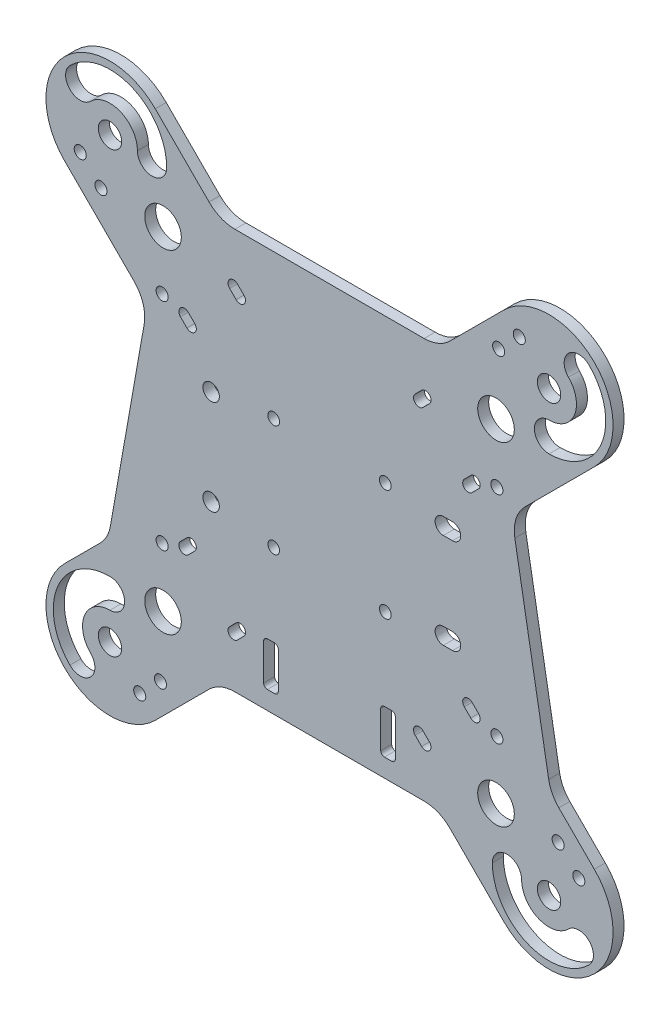
from build123d import *

# Parameters (mm, degrees)
AUFSATZ_LINEAR_AUSTRAGEN1_DEPTH = 3
SKIZZE2_R                       = 5
SKIZZE2_R_2                     = 3.2
SCHNITT_LINEAR_AUSTRAGEN1_DEPTH = 3
SKIZZE3_R                       = 3.2
SCHNITT_LINEAR_AUSTRAGEN2_DEPTH = 3
SKIZZE5_R                       = 1.6
SKIZZE5_R_2                     = 2.25
SCHNITT_LINEAR_AUSTRAGEN3_DEPTH = 3
SKIZZE7_R                       = 0.5
SCHNITT_LINEAR_AUSTRAGEN4_DEPTH = 110.64260121
VERRUNDUNG1_R                   = 10
ECSS_BEFESTIGUNG_DEPTH          = 110.64260121
SKIZZE9_R                       = 0.5
SCHNITT_LINEAR_AUSTRAGEN6_DEPTH = 110.64260121
KREISMUSTER1_COUNT              = 4
SKIZZE10_W                      = 4
SKIZZE10_H                      = 12
BEFESTIGUNG_SPANNTESTER_DEPTH   = 110.64260121
VERRUNDUNG2_R                   = 1
M4_GEWINDEBOHRUNG1_D            = 3.3
SKIZZE16_R                      = 0.5
SCHNITT_LINEAR_AUSTRAGEN8_DEPTH = 110.64260121
M4_GEWINDEBOHRUNG2_D            = 3.3


with BuildPart() as part:
    # Skizze1 → Aufsatz-Linear austragen1 (new body)
    with BuildSketch(Plane.XY):
        with BuildLine():
            Line((30, 54.748737342), (-30, 54.748737342))
            Line((-30, 54.748737342), (-47.625631329, 72.374368671))
            ThreePointArc((-47.625631329, 72.374368671), (-72.374368671, 72.374368671), (-72.374368671, 47.625631329))
            Line((-72.374368671, 47.625631329), (-49.748737342, 25))
            Line((-49.748737342, 25), (-60.45243751, -35.703700169))
            Line((-60.45243751, -35.703700169), (-72.374368671, -47.625631329))
            ThreePointArc((-72.374368671, -47.625631329), (-72.374368671, -72.374368671), (-47.625631329, -72.374368671))
            Line((-47.625631329, -72.374368671), (-30, -54.748737342))
            Line((-30, -54.748737342), (30, -54.748737342))
            Line((30, -54.748737342), (47.625631329, -72.374368671))
            ThreePointArc((47.625631329, -72.374368671), (72.374368671, -72.374368671), (72.374368671, -47.625631329))
            Line((72.374368671, -47.625631329), (60.45243751, -35.703700169))
            Line((60.45243751, -35.703700169), (49.748737342, 25))
            Line((49.748737342, 25), (72.374368671, 47.625631329))
            ThreePointArc((72.374368671, 47.625631329), (72.374368671, 72.374368671), (47.625631329, 72.374368671))
            Line((47.625631329, 72.374368671), (30, 54.748737342))
        make_face()
    extrude(amount=AUFSATZ_LINEAR_AUSTRAGEN1_DEPTH)

    # Skizze2 → Schnitt-Linear austragen1 (cut)
    with BuildSketch(Plane.XY.offset(3)):
        with Locations((-45.504310986, 45.504310986)):
            Circle(SKIZZE2_R)
        with Locations((-60, 60)):
            Circle(SKIZZE2_R_2)
        with Locations((45.504310986, 45.504310986)):
            Circle(SKIZZE2_R)
        with Locations((45.504310986, -45.504310986)):
            Circle(SKIZZE2_R)
        with Locations((-45.504310986, -45.504310986)):
            Circle(SKIZZE2_R)
        with Locations((-60, -60)):
            Circle(SKIZZE2_R_2)
        with Locations((60, 60)):
            Circle(SKIZZE2_R_2)
        with Locations((60, -60)):
            Circle(SKIZZE2_R_2)
    extrude(amount=-SCHNITT_LINEAR_AUSTRAGEN1_DEPTH, mode=Mode.SUBTRACT)

    # Skizze3 → Schnitt-Linear austragen2 (cut)
    with BuildSketch(Plane.XY.offset(3)):
        with Locations((-60, 60)):
            Circle(SKIZZE3_R)
        with BuildLine():
            ThreePointArc((65.303300859, 65.303300859), (65.303300859, 70.960155108), (70.960155108, 70.960155108))
            ThreePointArc((70.960155108, 70.960155108), (74.320132754, 54.068406798), (60, 44.5))
            ThreePointArc((60, 44.5), (56, 48.5), (60, 52.5))
            ThreePointArc((60, 52.5), (66.929096494, 57.129874257), (65.303300859, 65.303300859))
        make_face()
        with BuildLine():
            ThreePointArc((-70.960155108, 70.960155108), (-54.068406798, 74.320132754), (-44.5, 60))
            ThreePointArc((-44.5, 60), (-48.5, 56), (-52.5, 60))
            ThreePointArc((-52.5, 60), (-57.129874257, 66.929096494), (-65.303300859, 65.303300859))
            ThreePointArc((-65.303300859, 65.303300859), (-70.960155108, 65.303300859), (-70.960155108, 70.960155108))
        make_face()
        with BuildLine():
            ThreePointArc((65.303300859, -65.303300859), (57.129874257, -66.929096494), (52.5, -60))
            ThreePointArc((52.5, -60), (48.5, -56), (44.5, -60))
            ThreePointArc((44.5, -60), (54.068406798, -74.320132754), (70.960155108, -70.960155108))
            ThreePointArc((70.960155108, -70.960155108), (70.960155108, -65.303300859), (65.303300859, -65.303300859))
        make_face()
        with BuildLine():
            ThreePointArc((-70.960155108, -70.960155108), (-74.320132754, -54.068406798), (-60, -44.5))
            ThreePointArc((-60, -44.5), (-56, -48.5), (-60, -52.5))
            ThreePointArc((-60, -52.5), (-66.929096494, -57.129874257), (-65.303300859, -65.303300859))
            ThreePointArc((-65.303300859, -65.303300859), (-65.303300859, -70.960155108), (-70.960155108, -70.960155108))
        make_face()
    extrude(amount=-SCHNITT_LINEAR_AUSTRAGEN2_DEPTH, mode=Mode.SUBTRACT)

    # Skizze5 → Schnitt-Linear austragen3 (cut)
    with BuildSketch(Plane.XY.offset(3)):
        with Locations((-15.25, 15.25)):
            Circle(SKIZZE5_R)
        with Locations((15.25, 15.25)):
            Circle(SKIZZE5_R)
        with Locations((15.25, -15.25)):
            Circle(SKIZZE5_R)
        with Locations((-15.25, -15.25)):
            Circle(SKIZZE5_R)
        with Locations((-32.36, 13)):
            Circle(SKIZZE5_R_2)
        with Locations((-32.36, -13)):
            Circle(SKIZZE5_R_2)
        with BuildLine():
            Line((31.11, 15.25), (33.61, 15.25))
            ThreePointArc((33.61, 15.25), (35.86, 13), (33.61, 10.75))
            Line((33.61, 10.75), (31.11, 10.75))
            ThreePointArc((31.11, 10.75), (28.86, 13), (31.11, 15.25))
        make_face()
        with BuildLine():
            Line((31.11, -10.75), (33.61, -10.75))
            ThreePointArc((33.61, -10.75), (35.86, -13), (33.61, -15.25))
            Line((33.61, -15.25), (31.11, -15.25))
            ThreePointArc((31.11, -15.25), (28.86, -13), (31.11, -10.75))
        make_face()
    extrude(amount=-SCHNITT_LINEAR_AUSTRAGEN3_DEPTH, mode=Mode.SUBTRACT)

    # Skizze7 → Schnitt-Linear austragen4 (cut, through all)
    with BuildSketch(Plane.XY.offset(3)):
        with Locations((-45.748737342, 29.5)):
            Circle(SKIZZE7_R)
        with Locations((-45.748737342, -29.5)):
            Circle(SKIZZE7_R)
        with Locations((45.748737342, -29.5)):
            Circle(SKIZZE7_R)
        with Locations((45.748737342, 29.5)):
            Circle(SKIZZE7_R)
    extrude(amount=-SCHNITT_LINEAR_AUSTRAGEN4_DEPTH, mode=Mode.SUBTRACT)

    # Verrundung1
    verrundung1_edges = [part.edges().sort_by_distance(p)[0] for p in [
        (-30, 54.748737342, 1.5),
        (30, 54.748737342, 1.5),
        (49.748737342, 25, 1.5),
        (60.45243751, -35.703700169, 1.5),
        (30, -54.748737342, 1.5),
        (-30, -54.748737342, 1.5),
        (-60.45243751, -35.703700169, 1.5),
        (-49.748737342, 25, 1.5),
    ]]
    fillet(verrundung1_edges, radius=VERRUNDUNG1_R)

    # Skizze8 → ECSs Befestigung (cut, through all)
    with BuildSketch(Plane.XY.offset(3)):
        with BuildLine():
            Line((25.528544417, -38.256466479), (27.29631137, -40.024233431))
            ThreePointArc((27.29631137, -40.024233431), (27.29631137, -42.145553775), (25.174991027, -42.145553775))
            Line((25.174991027, -42.145553775), (23.407224074, -40.377786822))
            ThreePointArc((23.407224074, -40.377786822), (23.407224074, -38.256466479), (25.528544417, -38.256466479))
        make_face()
        with BuildLine():
            Line((38.610019869, -28.710524932), (36.842252916, -26.94275798))
            ThreePointArc((36.842252916, -26.94275798), (36.842252916, -24.821437636), (38.96357326, -24.821437636))
            Line((38.96357326, -24.821437636), (40.731340213, -26.589204589))
            ThreePointArc((40.731340213, -26.589204589), (40.731340213, -28.710524932), (38.610019869, -28.710524932))
        make_face()
        with BuildLine():
            Line((-38.610019869, -28.710524932), (-36.842252916, -26.94275798))
            ThreePointArc((-36.842252916, -26.94275798), (-36.842252916, -24.821437636), (-38.96357326, -24.821437636))
            Line((-38.96357326, -24.821437636), (-40.731340213, -26.589204589))
            ThreePointArc((-40.731340213, -26.589204589), (-40.731340213, -28.710524932), (-38.610019869, -28.710524932))
        make_face()
        with BuildLine():
            Line((-25.528544417, -38.256466479), (-27.29631137, -40.024233431))
            ThreePointArc((-27.29631137, -40.024233431), (-27.29631137, -42.145553775), (-25.174991027, -42.145553775))
            Line((-25.174991027, -42.145553775), (-23.407224074, -40.377786822))
            ThreePointArc((-23.407224074, -40.377786822), (-23.407224074, -38.256466479), (-25.528544417, -38.256466479))
        make_face()
        with BuildLine():
            Line((-25.528544417, 38.256466479), (-27.29631137, 40.024233431))
            ThreePointArc((-27.29631137, 40.024233431), (-27.29631137, 42.145553775), (-25.174991027, 42.145553775))
            Line((-25.174991027, 42.145553775), (-23.407224074, 40.377786822))
            ThreePointArc((-23.407224074, 40.377786822), (-23.407224074, 38.256466479), (-25.528544417, 38.256466479))
        make_face()
        with BuildLine():
            Line((-38.610019869, 28.710524932), (-36.842252916, 26.94275798))
            ThreePointArc((-36.842252916, 26.94275798), (-36.842252916, 24.821437636), (-38.96357326, 24.821437636))
            Line((-38.96357326, 24.821437636), (-40.731340213, 26.589204589))
            ThreePointArc((-40.731340213, 26.589204589), (-40.731340213, 28.710524932), (-38.610019869, 28.710524932))
        make_face()
        with BuildLine():
            Line((38.610019869, 28.710524932), (36.842252916, 26.94275798))
            ThreePointArc((36.842252916, 26.94275798), (36.842252916, 24.821437636), (38.96357326, 24.821437636))
            Line((38.96357326, 24.821437636), (40.731340213, 26.589204589))
            ThreePointArc((40.731340213, 26.589204589), (40.731340213, 28.710524932), (38.610019869, 28.710524932))
        make_face()
        with BuildLine():
            Line((25.528544417, 38.256466479), (27.29631137, 40.024233431))
            ThreePointArc((27.29631137, 40.024233431), (27.29631137, 42.145553775), (25.174991027, 42.145553775))
            Line((25.174991027, 42.145553775), (23.407224074, 40.377786822))
            ThreePointArc((23.407224074, 40.377786822), (23.407224074, 38.256466479), (25.528544417, 38.256466479))
        make_face()
    extrude(amount=-ECSS_BEFESTIGUNG_DEPTH, mode=Mode.SUBTRACT)

    # Skizze9 → Schnitt-Linear austragen6 (cut, through all)
    with BuildSketch(Plane.XY.offset(3)):
        with Locations((46.211417767, 62.474873734)):
            Circle(SKIZZE9_R)
    schnitt_linear_austragen6 = extrude(amount=-SCHNITT_LINEAR_AUSTRAGEN6_DEPTH, mode=Mode.SUBTRACT)

    # Kreismuster1: Schnitt-Linear austragen6 ×4 about axis
    kreismuster1_axis = Axis((0, 0, 0), (0, 0, 1))
    for i in range(1, KREISMUSTER1_COUNT):
        add(schnitt_linear_austragen6.rotate(kreismuster1_axis, i * 360 / KREISMUSTER1_COUNT), mode=Mode.SUBTRACT)

    # Skizze10 → Befestigung SpannTester (cut, through all)
    with BuildSketch(Plane.XY.offset(3)):
        with Locations((-16, -43.748737342)):
            Rectangle(SKIZZE10_W, SKIZZE10_H)
        with Locations((16, -43.748737342)):
            Rectangle(SKIZZE10_W, SKIZZE10_H)
    extrude(amount=-BEFESTIGUNG_SPANNTESTER_DEPTH, mode=Mode.SUBTRACT)

    # Verrundung2
    verrundung2_edges = [part.edges().sort_by_distance(p)[0] for p in [
        (-18, -49.748737342, 1.5),
        (-18, -37.748737342, 1.5),
        (-14, -37.748737342, 1.5),
        (-14, -49.748737342, 1.5),
        (18, -37.748737342, 1.5),
        (18, -49.748737342, 1.5),
        (14, -49.748737342, 1.5),
        (14, -37.748737342, 1.5),
    ]]
    fillet(verrundung2_edges, radius=VERRUNDUNG2_R)

    # M4 Gewindebohrung1 (through all)
    with Locations(Plane.XY.offset(3)):
        with Locations((-45.748737342, 29.5), (-62.474873734, 46.211417767), (-46.211417767, -62.474873734), (-45.748737342, -29.5), (45.748737342, 29.5), (45.748737342, -29.5), (62.474873734, -46.211417767), (46.211417767, 62.474873734)):
            Hole(M4_GEWINDEBOHRUNG1_D / 2)

    # Skizze16 → Schnitt-Linear austragen8 (cut, through all)
    with BuildSketch(Plane.XY.offset(3)):
        with Locations((-51.868272016, -68.131727984)):
            Circle(SKIZZE16_R)
        with Locations((-68.131727984, 51.868272016)):
            Circle(SKIZZE16_R)
        with Locations((51.868272016, 68.131727984)):
            Circle(SKIZZE16_R)
        with Locations((68.131727984, -51.868272016)):
            Circle(SKIZZE16_R)
    extrude(amount=-SCHNITT_LINEAR_AUSTRAGEN8_DEPTH, mode=Mode.SUBTRACT)

    # M4 Gewindebohrung2 (through all)
    with Locations(Plane.XY.offset(3)):
        with Locations((-51.868272016, -68.131727984), (-68.131727984, 51.868272016), (51.868272016, 68.131727984), (68.131727984, -51.868272016)):
            Hole(M4_GEWINDEBOHRUNG2_D / 2)


solid = part.part
